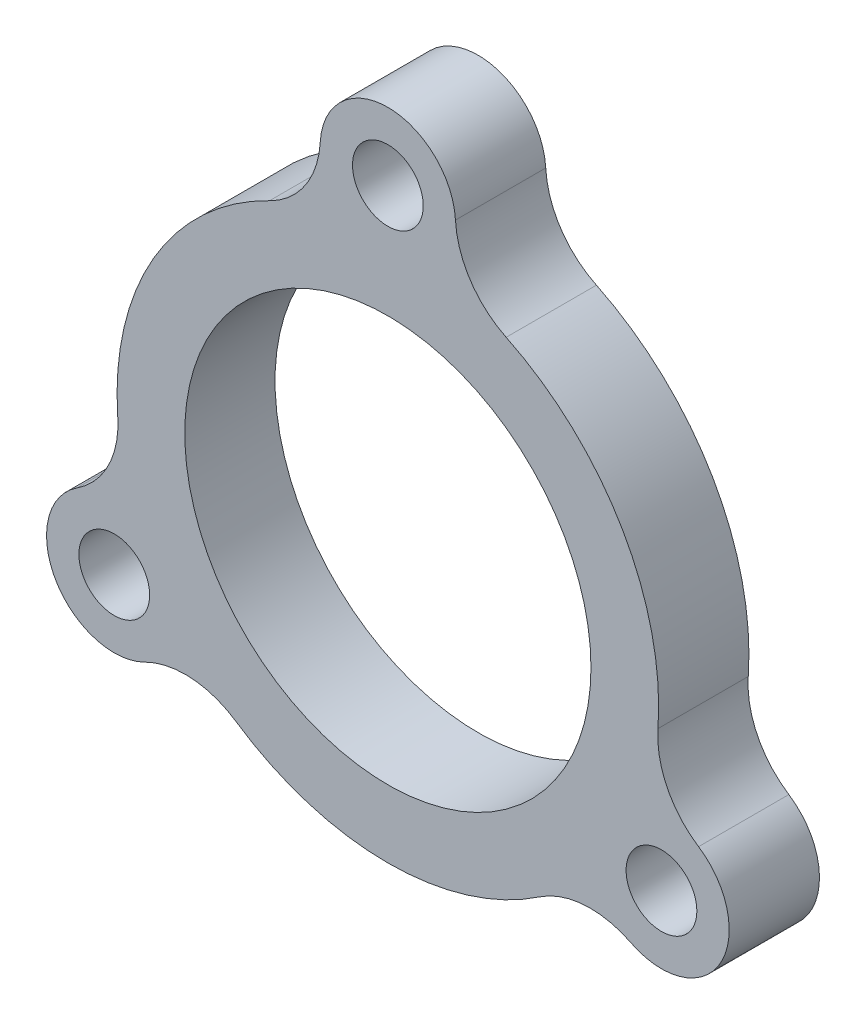
from build123d import *

# Parameters (mm, degrees)
SKETCH2_R           = 4.7625
SKETCH2_R_2         = 2.4892
SKETCH2_R_3         = 19.05
SKETCH2_R_4         = 14.2875
BOSS_EXTRUDE1_DEPTH = 6.35
FILLET2_R           = 6.35


with BuildPart() as part:
    # Sketch2 → Boss-Extrude1 (new body)
    # profile 1 of 4: a face of its own
    with BuildSketch(Plane.XY):
        with Locations((19.247414599, -11.1125)):
            Circle(SKETCH2_R)
        with Locations((19.247414599, -11.1125)):
            Circle(SKETCH2_R_2, mode=Mode.SUBTRACT)
    # profile 2 of 4: a face of its own
    with BuildSketch(Plane.XY):
        Circle(SKETCH2_R_3)
        Circle(SKETCH2_R_4, mode=Mode.SUBTRACT)
    # profile 3 of 4: a face of its own
    with BuildSketch(Plane.XY):
        with Locations((0, 22.225)):
            Circle(SKETCH2_R)
        with Locations((0, 22.225)):
            Circle(SKETCH2_R_2, mode=Mode.SUBTRACT)
    # profile 4 of 4: a face of its own
    with BuildSketch(Plane.XY):
        with Locations((-19.247414599, -11.1125)):
            Circle(SKETCH2_R)
        with Locations((-19.247414599, -11.1125)):
            Circle(SKETCH2_R_2, mode=Mode.SUBTRACT)
    extrude(amount=BOSS_EXTRUDE1_DEPTH)

    # Fillet2
    fillet2_edges = [part.edges().sort_by_distance(p)[0] for p in [
        (-17.88937524, -6.547728883, 3.175),
        (-3.27418807, 18.766517857, 3.175),
        (3.27418807, 18.766517857, 3.175),
        (17.88937524, -6.547728883, 3.175),
        (14.61518717, -12.218788974, 3.175),
        (-14.61518717, -12.218788974, 3.175),
    ]]
    fillet(fillet2_edges, radius=FILLET2_R)


solid = part.part
